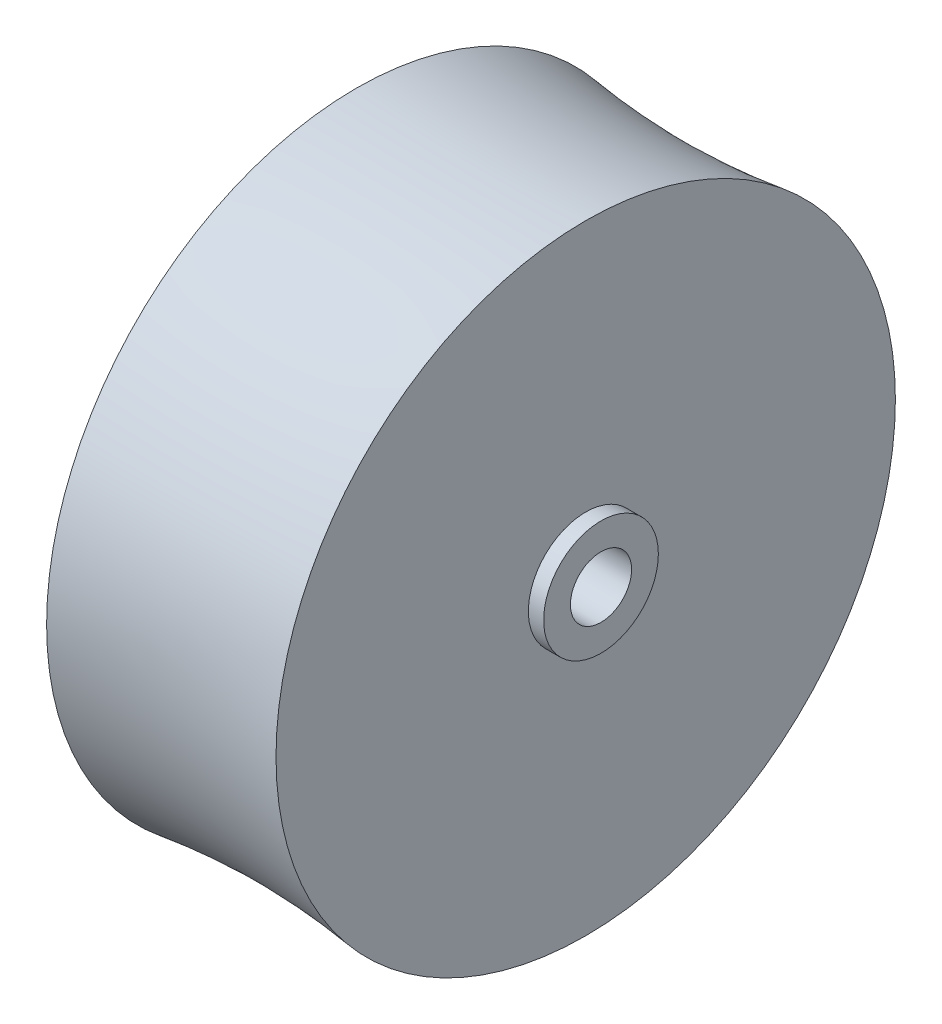
from build123d import *


with BuildPart() as part:
    # Sketch1 → Revolve1 (revolve)
    with BuildSketch(Plane.XY, mode=Mode.PRIVATE) as revolve1_sk:
        with BuildLine():
            Line((-34, 7.5), (-34, 4))
            Line((-34, 4), (0, 4))
            Line((0, 4), (0, 7.5))
            Line((0, 7.5), (-2, 7.5))
            Line((-2, 7.5), (-2, 40.5))
            add(Edge.make_bspline(
                [(-32, 40.5), (-17, 38.5), (-2, 40.5)],
                knots=[0, 0, 0, 1, 1, 1], degree=2))
            Line((-32, 40.5), (-32, 7.5))
            Line((-32, 7.5), (-34, 7.5))
        make_face()
    revolve(revolve1_sk.sketch.rotate(Axis((0, 0, 0), (-1, 0, 0)), 90), axis=Axis((0, 0, 0), (-1, 0, 0)))


solid = part.part
